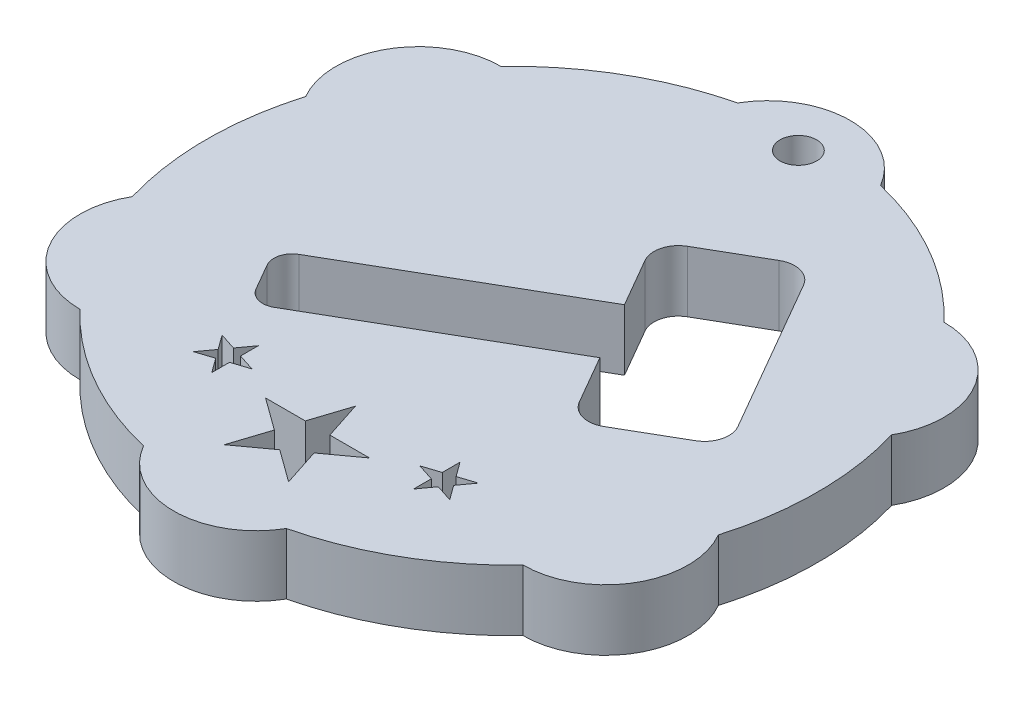
from build123d import *

# Parameters (mm, degrees)
SKETCH1_R           = 3
BOSS_EXTRUDE1_DEPTH = 10


with BuildPart() as part:
    # Sketch1 → Boss-Extrude1 (new body)
    with BuildSketch(Plane(origin=(0, 0, 0), x_dir=(1, 0, 0), z_dir=(0, 1, 0))):
        with BuildLine():
            ThreePointArc((-11.691342951, 48.613912618), (-25, 43.301270189), (-36.255211829, 34.431956309))
            ThreePointArc((-36.255211829, 34.431956309), (-47.94655478, 27.681956309), (-47.94655478, 14.181956309))
            ThreePointArc((-47.94655478, 14.181956309), (-50, 0), (-47.94655478, -14.181956309))
            ThreePointArc((-47.94655478, -14.181956309), (-47.94655478, -27.681956309), (-36.255211829, -34.431956309))
            ThreePointArc((-36.255211829, -34.431956309), (-25, -43.301270189), (-11.691342951, -48.613912618))
            ThreePointArc((-11.691342951, -48.613912618), (0, -55.363912618), (11.691342951, -48.613912618))
            ThreePointArc((11.691342951, -48.613912618), (25, -43.301270189), (36.255211829, -34.431956309))
            ThreePointArc((36.255211829, -34.431956309), (47.94655478, -27.681956309), (47.94655478, -14.181956309))
            ThreePointArc((47.94655478, -14.181956309), (50, 0), (47.94655478, 14.181956309))
            ThreePointArc((47.94655478, 14.181956309), (47.94655478, 27.681956309), (36.255211829, 34.431956309))
            ThreePointArc((36.255211829, 34.431956309), (25, 43.301270189), (11.691342951, 48.613912618))
            ThreePointArc((11.691342951, 48.613912618), (0, 55.363912618), (-11.691342951, 48.613912618))
        make_face()
        with Locations(Location((0, 46.863912618, 0), (0, 0, 270))):
            Circle(SKETCH1_R, mode=Mode.SUBTRACT)
        with BuildLine():
            Line((-27.230762114, -12.834936491), (-24.730762114, -17.165063509))
            ThreePointArc((-24.730762114, -17.165063509), (-22.909143037, -18.562840988), (-20.632685902, -18.263139721))
            Line((-20.632685902, -18.263139721), (13.142304845, 1.236860279))
            Line((13.142304845, 1.236860279), (17.742304845, -6.730573436))
            ThreePointArc((17.742304845, -6.730573436), (20.17113028, -8.594276741), (23.206406461, -8.194675051))
            Line((23.206406461, -8.194675051), (32.732685902, -2.694675051))
            ThreePointArc((32.732685902, -2.694675051), (34.596389207, -0.265849616), (34.196787517, 2.769426564))
            Line((34.196787517, 2.769426564), (19.496787517, 28.230573436))
            ThreePointArc((19.496787517, 28.230573436), (17.067962083, 30.094276741), (14.032685902, 29.694675051))
            Line((14.032685902, 29.694675051), (4.506406461, 24.194675051))
            ThreePointArc((4.506406461, 24.194675051), (2.642703155, 21.765849616), (3.042304845, 18.730573436))
            Line((3.042304845, 18.730573436), (7.642304845, 10.763139721))
            Line((7.642304845, 10.763139721), (-26.132685902, -8.736860279))
            ThreePointArc((-26.132685902, -8.736860279), (-27.530463381, -10.558479355), (-27.230762114, -12.834936491))
        make_face(mode=Mode.SUBTRACT)
        Polygon((-2.008610463, -31.818132644), (0, -25.636265288), (2.008610463, -31.818132644), (8.508610463, -31.818132644), (3.25, -35.638736784), (5.258610463, -41.82060414), (0, -38), (-5.258610463, -41.82060414), (-3.25, -35.638736784), (-8.508610463, -31.818132644), align=None, mode=Mode.SUBTRACT)
        Polygon((13.742304845, -28.81792347), (16.506236868, -27.919867517), (16.506236868, -25.013697405), (18.2144408, -27.364838414), (20.978372823, -26.466782461), (19.27016889, -28.81792347), (20.978372823, -31.16906448), (18.2144408, -30.271008526), (16.506236868, -32.622149536), (16.506236868, -29.715979424), align=None, mode=Mode.SUBTRACT)
        Polygon((-13.742304845, -28.81792347), (-16.506236868, -27.919867517), (-16.506236868, -25.013697405), (-18.2144408, -27.364838414), (-20.978372823, -26.466782461), (-19.27016889, -28.81792347), (-20.978372823, -31.16906448), (-18.2144408, -30.271008526), (-16.506236868, -32.622149536), (-16.506236868, -29.715979424), align=None, mode=Mode.SUBTRACT)
    extrude(amount=BOSS_EXTRUDE1_DEPTH)


solid = part.part
